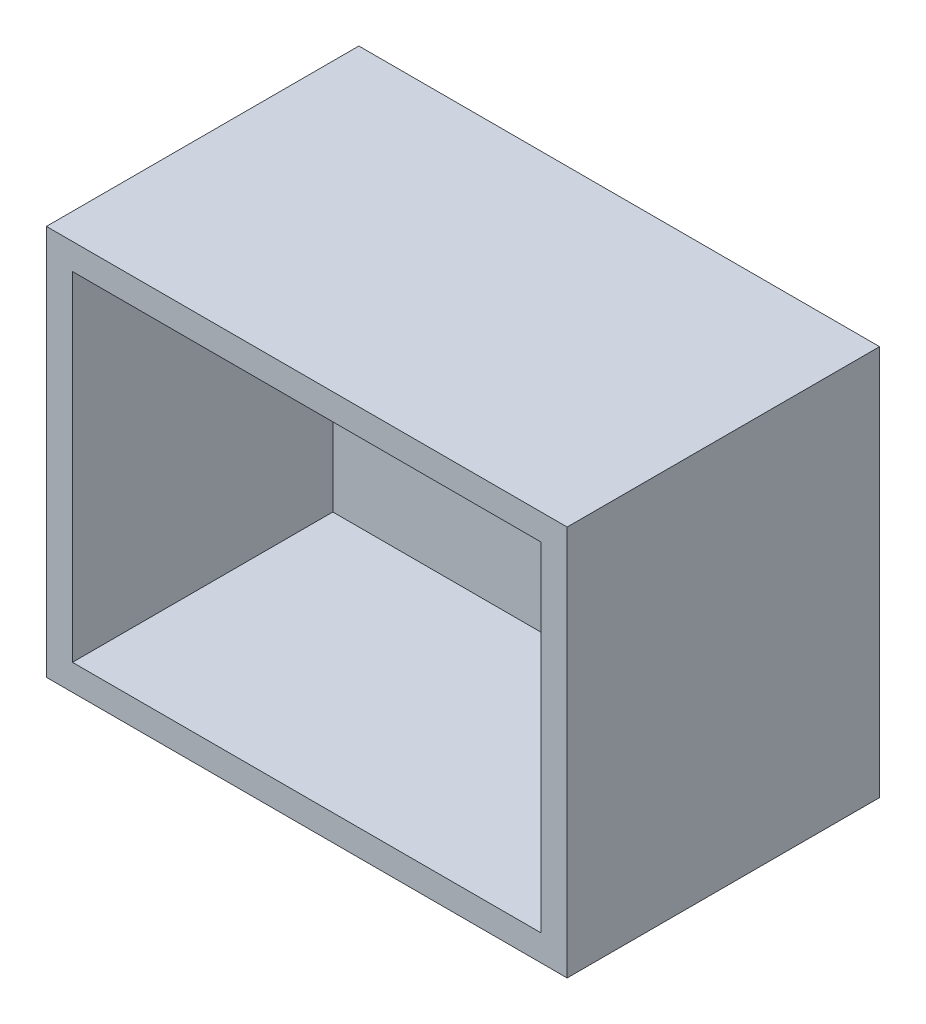
from build123d import *

# Parameters (mm, degrees)
SKIZZE1_W                       = 200
SKIZZE1_H                       = 150
AUFSATZ_LINEAR_AUSTRAGEN1_DEPTH = 120
SKIZZE2_W                       = 180
SKIZZE2_H                       = 130
SCHNITT_LINEAR_AUSTRAGEN1_DEPTH = 100


with BuildPart() as part:
    # Skizze1 → Aufsatz-Linear austragen1 (new body)
    with BuildSketch(Plane.XY):
        Rectangle(SKIZZE1_W, SKIZZE1_H)
    extrude(amount=AUFSATZ_LINEAR_AUSTRAGEN1_DEPTH)

    # Skizze2 → Schnitt-Linear austragen1 (cut)
    with BuildSketch(Plane.XY.offset(120)):
        Rectangle(SKIZZE2_W, SKIZZE2_H)
    extrude(amount=-SCHNITT_LINEAR_AUSTRAGEN1_DEPTH, mode=Mode.SUBTRACT)


solid = part.part
